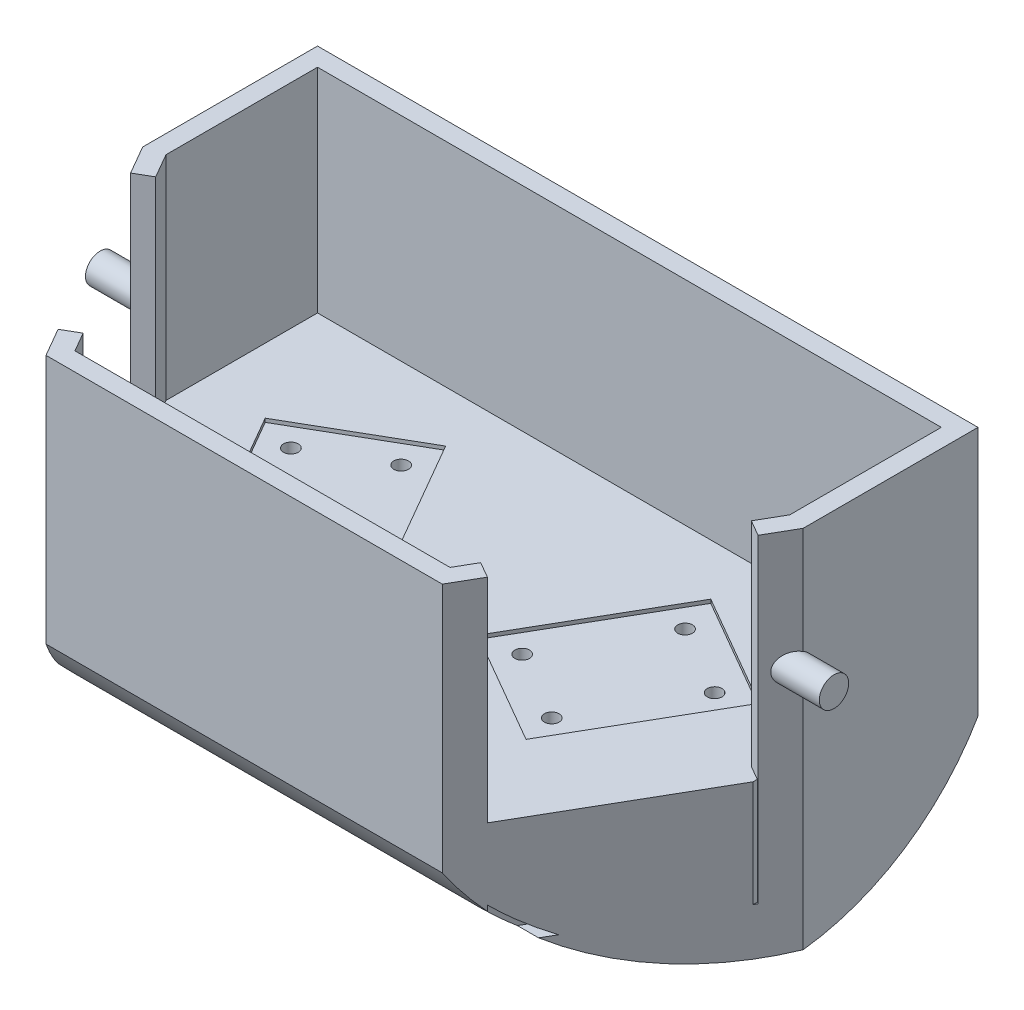
from build123d import *

# Parameters (mm, degrees)
BOSS_EXTRUDE1_DEPTH             = 50
BOSS_EXTRUDE1_DEPTH_BACK        = 50
CUT_EXTRUDE9_REACH              = 196.743
SHELL1_T                        = -5
SKETCH5_W                       = 54
SKETCH5_H                       = 87
CUT_EXTRUDE2_DEPTH              = 5
BOSS_EXTRUDE4_REACH             = 192.132
SKETCH6_R                       = 2
CUT_EXTRUDE4_DEPTH              = 121.370262108
SKETCH6_4_R                     = 2
CUT_EXTRUDE5_DEPTH              = 1
CUT_EXTRUDE10_REACH             = 122.37
SKETCH18_R                      = 4
BOSS_EXTRUDE5_DEPTH             = 10
BOSS_EXTRUDE5_DIRECTION_2_REACH = 196.743


with BuildPart() as part:
    # Sketch2 → Boss-Extrude1 (new, two sides: drawn at the far end of the back side and taken through both)
    with BuildSketch(Plane(origin=(0, 0, 0), x_dir=(1, 0, 0), z_dir=(0, 1, 0)).offset(-BOSS_EXTRUDE1_DEPTH_BACK)):
        Polygon((-90, 7.353829072), (-54, -55), (54, -55), (90, 7.353829072), (90, 55), (-90, 55), align=None)
    extrude(amount=BOSS_EXTRUDE1_DEPTH + BOSS_EXTRUDE1_DEPTH_BACK)

    # Sketch13 → Cut-Extrude9 (cut, up to next)
    with BuildSketch(Plane.ZY.offset(90), mode=Mode.PRIVATE) as cut_extrude9_sk1:
        with BuildLine():
            Line((-55, -18.147205482), (-55, -50))
            Line((-55, -50), (-7.353829072, -50))
            Line((-7.353829072, -50), (-7.353829072, -49.472813016))
            ThreePointArc((-7.353829072, -49.472813016), (-34.89016225, -39.45784976), (-55, -18.147205482))
        make_face()
    cut_extrude9_tool1 = extrude(cut_extrude9_sk1.sketch, amount=-CUT_EXTRUDE9_REACH, mode=Mode.PRIVATE) & part.part
    # Sketch13 → Cut-Extrude9 (cut, up to next)
    with BuildSketch(Plane.ZY.offset(90), mode=Mode.PRIVATE) as cut_extrude9_sk2:
        with BuildLine():
            Line((-7.353829072, -49.472813016), (-7.353829072, -50))
            Line((-7.353829072, -50), (55, -50))
            Line((55, -50), (55, -18.147205482))
            ThreePointArc((55, -18.147205482), (28.510749251, -43.140835035), (-7.353829072, -49.472813016))
        make_face()
    cut_extrude9_tool2 = extrude(cut_extrude9_sk2.sketch, amount=-CUT_EXTRUDE9_REACH, mode=Mode.PRIVATE) & part.part
    add(cut_extrude9_tool1.solids().sort_by_distance((-90, -41.055355, -42.003091))[0], mode=Mode.SUBTRACT)
    add(cut_extrude9_tool2.solids().sort_by_distance((-90, -41.116139, 41.712636))[0], mode=Mode.SUBTRACT)

    # Shell1
    shell1_openings = [part.faces().sort_by_distance(p)[0] for p in [
        (0, 50, -4.375017638),
    ]]
    offset(amount=SHELL1_T, openings=shell1_openings, kind=Kind.INTERSECTION)

    # Sketch5 → Cut-Extrude2 (cut)
    with BuildSketch(Plane(origin=(-64.315698604, 0, 37.132685902), x_dir=(0.500000000000001, 0, 0.8660254037844382), z_dir=(-0.866025403784438, 0, 0.5000000000000009))):
        with Locations((-15.368602792, 6.5)):
            Rectangle(SKETCH5_W, SKETCH5_H)
    cut_extrude2 = extrude(amount=-CUT_EXTRUDE2_DEPTH, mode=Mode.SUBTRACT)

    # Mirror1: Cut-Extrude2 across plane
    add(cut_extrude2.mirror(Plane(origin=(0, 0, 0), x_dir=(0, 0, 1), z_dir=(1, 0, 0))), mode=Mode.SUBTRACT)

    # Boss-Extrude4: up to this face of the body (flat: up to its plane)
    boss_extrude4_end = Plane(part.part.faces().sort_by_distance((85, 7.162435056, -28.298353868))[0])
    # Sketch16 → Boss-Extrude4 (add, up to the picked face)
    with BuildSketch(Plane(origin=(-85, 0, 0), x_dir=(0, 0, -1), z_dir=(1, 0, 0)), mode=Mode.PRIVATE) as boss_extrude4_sk1:
        with BuildLine():
            Line((-55, -8), (55, -8))
            Line((55, -8), (55, -18.147205482))
            ThreePointArc((55, -18.147205482), (0, -46.778395033), (-55, -18.147205482))
            Line((-55, -18.147205482), (-55, -8))
        make_face()
    boss_extrude4_tool1 = split(extrude(boss_extrude4_sk1.sketch, amount=BOSS_EXTRUDE4_REACH, mode=Mode.PRIVATE), bisect_by=boss_extrude4_end, keep=Keep.BOTH, mode=Mode.PRIVATE)
    add(boss_extrude4_tool1.solids().sort_by(Axis((-85, -24.21168, 0), (1, 0, 0)))[0])

    # Sketch6 → Cut-Extrude4 (cut, through all)
    with BuildSketch(Plane(origin=(0, -8, 0), x_dir=(1, 0, 0), z_dir=(0, 1, 0))):
        with Locations(Location((-57.742314098, 15.481878155, 0), (0, 0, 270))):
            Circle(SKETCH6_R)
        with Locations(Location((-38.689755215, 26.481878155, 0), (0, 0, 270))):
            Circle(SKETCH6_R)
        with Locations(Location((-41.492314098, -12.663947468, 0), (0, 0, 270))):
            Circle(SKETCH6_R)
        with Locations(Location((-22.439755215, -1.663947468, 0), (0, 0, 270))):
            Circle(SKETCH6_R)
        with Locations(Location((22.439755215, -1.663947468, 0), (0, 0, 56.302025246))):
            Circle(SKETCH6_R)
        with Locations(Location((41.492314098, -12.663947468, 0), (0, 0, 270))):
            Circle(SKETCH6_R)
        with Locations(Location((38.689755215, 26.481878155, 0), (0, 0, 270))):
            Circle(SKETCH6_R)
        with Locations(Location((57.742314098, 15.481878155, 0), (0, 0, 270))):
            Circle(SKETCH6_R)
    extrude(amount=-CUT_EXTRUDE4_DEPTH, mode=Mode.SUBTRACT)

    # Sketch6<4> → Cut-Extrude5 (cut)
    # profile 1 of 2: a face of its own
    with BuildSketch(Plane(origin=(0, -8, 0), x_dir=(1, 0, 0), z_dir=(0, 1, 0))):
        Polygon((36.127577388, 36.044055982), (67.304491924, 18.044055982), (44.054491924, -22.226125294), (12.877577388, -4.226125294), align=None)
        with Locations(Location((38.689755215, 26.481878155, 0), (0, 0, 270))):
            Circle(SKETCH6_4_R, mode=Mode.SUBTRACT)
        with Locations(Location((22.439755215, -1.663947468, 0), (0, 0, 270))):
            Circle(SKETCH6_4_R, mode=Mode.SUBTRACT)
        with Locations(Location((41.492314098, -12.663947468, 0), (0, 0, 270))):
            Circle(SKETCH6_4_R, mode=Mode.SUBTRACT)
        with Locations(Location((57.742314098, 15.481878155, 0), (0, 0, 270))):
            Circle(SKETCH6_4_R, mode=Mode.SUBTRACT)
    # profile 2 of 2: a face of its own
    with BuildSketch(Plane(origin=(0, -8, 0), x_dir=(1, 0, 0), z_dir=(0, 1, 0))):
        Polygon((-36.127577388, 36.044055982), (-12.877577388, -4.226125294), (-44.054491924, -22.226125294), (-67.304491924, 18.044055982), align=None)
    extrude(amount=-CUT_EXTRUDE5_DEPTH, mode=Mode.SUBTRACT)

    # Sketch17 → Cut-Extrude10 (cut, up to next)
    with BuildSketch(Plane(origin=(0, -8, 0), x_dir=(1, 0, 0), z_dir=(0, 1, 0)), mode=Mode.PRIVATE) as cut_extrude10_sk1:
        Polygon((-54, -55), (-85, -55), (-85, -1.306424965), align=None)
    cut_extrude10_tool1 = extrude(cut_extrude10_sk1.sketch, amount=-CUT_EXTRUDE10_REACH, mode=Mode.PRIVATE) & part.part
    # Sketch17 → Cut-Extrude10 (cut, up to next)
    with BuildSketch(Plane(origin=(0, -8, 0), x_dir=(1, 0, 0), z_dir=(0, 1, 0)), mode=Mode.PRIVATE) as cut_extrude10_sk2:
        Polygon((85, -55), (54, -55), (85, -1.306424965), align=None)
    cut_extrude10_tool2 = extrude(cut_extrude10_sk2.sketch, amount=-CUT_EXTRUDE10_REACH, mode=Mode.PRIVATE) & part.part
    add(cut_extrude10_tool1.solids().sort_by_distance((-74.666667, -8, 37.102142))[0], mode=Mode.SUBTRACT)
    add(cut_extrude10_tool2.solids().sort_by_distance((74.666667, -8, 37.102142))[0], mode=Mode.SUBTRACT)

    # Sketch18 → Boss-Extrude5 (add)
    with BuildSketch(Plane.ZY.offset(90)):
        with Locations((-5.755783353, 17.2426)):
            Circle(SKETCH18_R)
    boss_extrude5 = extrude(amount=BOSS_EXTRUDE5_DEPTH)

    # Sketch18 → Boss-Extrude5 direction 2 (add, up to next)
    with BuildSketch(Plane.ZY.offset(90), mode=Mode.PRIVATE) as boss_extrude5_direction_2_sk1:
        with Locations((-5.755783353, 17.2426)):
            Circle(SKETCH18_R)
    boss_extrude5_direction_2_tool1 = extrude(boss_extrude5_direction_2_sk1.sketch, amount=-BOSS_EXTRUDE5_DIRECTION_2_REACH, mode=Mode.PRIVATE) - part.part
    boss_extrude5_direction_2 = boss_extrude5_direction_2_tool1.solids().sort_by_distance((-90, 17.2426, -5.755783))[0]
    add(boss_extrude5_direction_2)

    # Mirror2: Boss-Extrude5, Boss-Extrude5 direction 2 across plane
    add(boss_extrude5.mirror(Plane(origin=(0, 0, 0), x_dir=(0, 0, 1), z_dir=(1, 0, 0))))
    add(boss_extrude5_direction_2.mirror(Plane(origin=(0, 0, 0), x_dir=(0, 0, 1), z_dir=(1, 0, 0))))


solid = part.part
